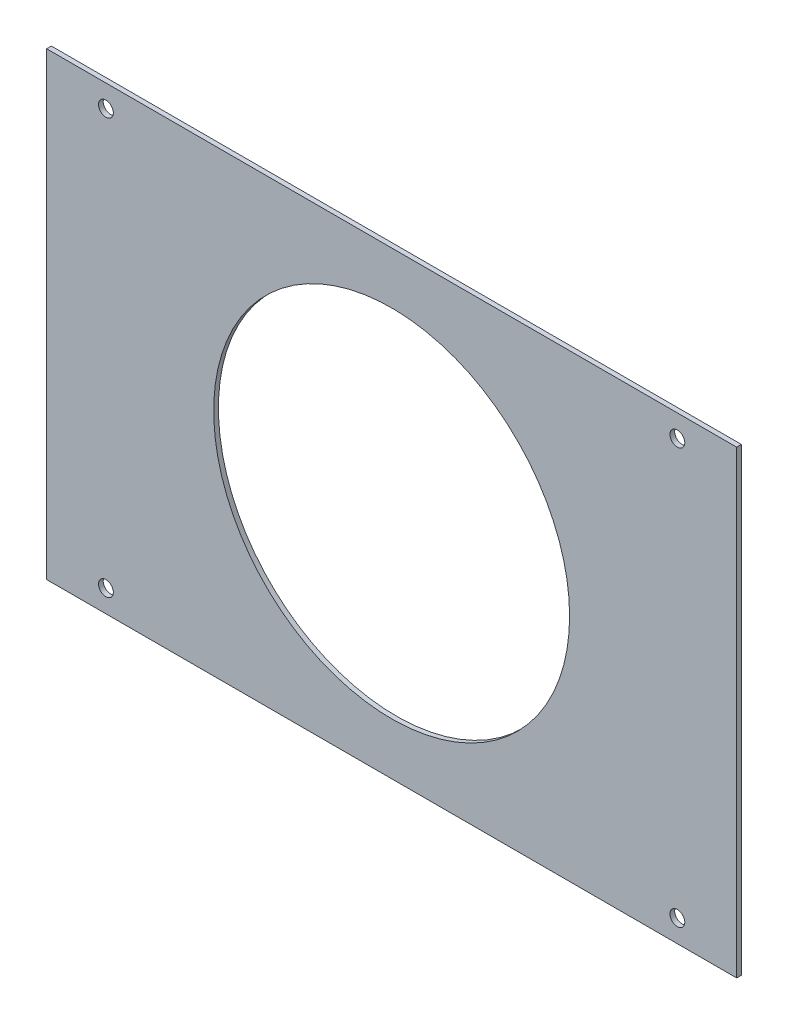
from build123d import *

# Parameters (mm, degrees)
SKETCH1_W           = 232.6676516
SKETCH1_H           = 155
BOSS_EXTRUDE1_DEPTH = 1.5875
SKETCH2_R           = 60
CUT_EXTRUDE1_DEPTH  = 204.242095442
SKETCH6_R           = 2.5
CUT_EXTRUDE2_DEPTH  = 204.242095442


with BuildPart() as part:
    # Sketch1 → Boss-Extrude1 (new body)
    with BuildSketch(Plane.XY):
        with Locations((33.576399593, -59.72883635)):
            Rectangle(SKETCH1_W, SKETCH1_H)
    extrude(amount=BOSS_EXTRUDE1_DEPTH)

    # Sketch2 → Cut-Extrude1 (cut, through all)
    with BuildSketch(Plane.XY.offset(1.5875)):
        with Locations((33.576399593, -59.72883635)):
            Circle(SKETCH2_R)
    extrude(amount=-CUT_EXTRUDE1_DEPTH, mode=Mode.SUBTRACT)

    # Sketch6 → Cut-Extrude2 (cut, through all)
    with BuildSketch(Plane.XY.offset(1.5875)):
        with Locations((129.910225393, 10.27116365)):
            Circle(SKETCH6_R)
        with Locations((129.910225393, -129.72883635)):
            Circle(SKETCH6_R)
        with Locations((-62.757426207, 10.27116365)):
            Circle(SKETCH6_R)
        with Locations((-62.757426207, -129.72883635)):
            Circle(SKETCH6_R)
    extrude(amount=-CUT_EXTRUDE2_DEPTH, mode=Mode.SUBTRACT)


solid = part.part
